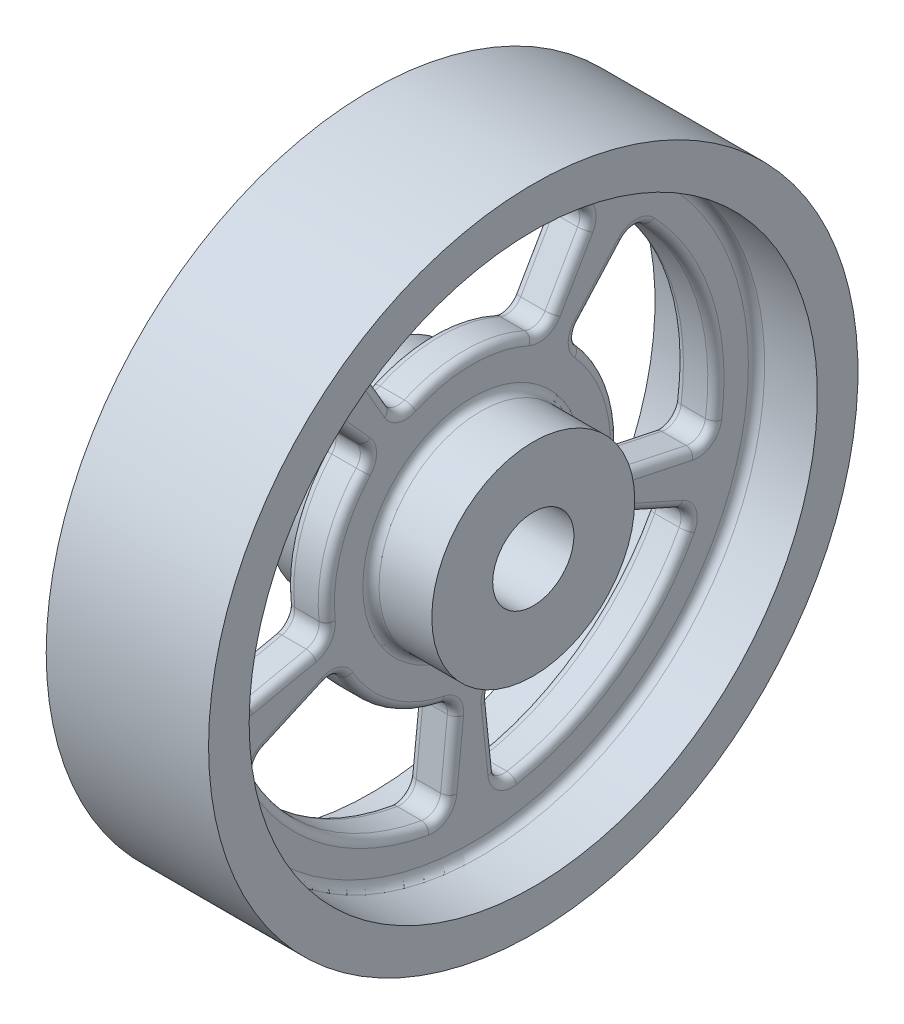
from build123d import *

# Parameters (mm, degrees)
CUT_EXTRUDE1_DEPTH       = 58.933151131
FILLET2_R                = 2
FILLET3_R                = 2
FILLET4_R                = 2
FILLET5_R                = 2
CIRPATTERN1_COUNT        = 5
FILLET2_OF_CIRPATTERN1_R = 2
FILLET3_OF_CIRPATTERN1_R = 2
FILLET4_OF_CIRPATTERN1_R = 2
FILLET5_OF_CIRPATTERN1_R = 2
FILLET11_R               = 1
FILLET12_R               = 1


with BuildPart() as part:
    # Sketch2 → Revolve1 (revolve)
    with BuildSketch(Plane.XY, mode=Mode.PRIVATE) as revolve1_sk:
        Polygon((-10, 35), (-2.5, 35), (-2.5, 12.5), (-10, 12.5), (-10, 5), (10, 5), (10, 12.5), (2.5, 12.5), (2.5, 35), (10, 35), (10, 40), (-10, 40), align=None)
    revolve(revolve1_sk.sketch.rotate(Axis((0, 0, 0), (1, 0, 0)), 90), axis=Axis((0, 0, 0), (1, 0, 0)))

    # Sketch4 → Cut-Extrude1 (cut, through all)
    with BuildSketch(Plane(origin=(2.5, 0, 0), x_dir=(0, 0, -1), z_dir=(1, 0, 0))):
        with BuildLine():
            Line((-15, 25.980762114), (-9, 15.588457268))
            ThreePointArc((-9, 15.588457268), (0, 18), (9, 15.588457268))
            Line((9, 15.588457268), (15, 25.980762114))
            ThreePointArc((15, 25.980762114), (0, 30), (-15, 25.980762114))
        make_face()
    cut_extrude1 = extrude(amount=-CUT_EXTRUDE1_DEPTH, mode=Mode.SUBTRACT)

    # Fillet2
    fillet2_edges = [part.edges().sort_by_distance(p)[0] for p in [
        (0, 25.980762114, -15),
    ]]
    fillet(fillet2_edges, radius=FILLET2_R)

    # Fillet3
    fillet3_edges = [part.edges().sort_by_distance(p)[0] for p in [
        (0, 15.588457268, -9),
    ]]
    fillet(fillet3_edges, radius=FILLET3_R)

    # Fillet4
    fillet4_edges = [part.edges().sort_by_distance(p)[0] for p in [
        (0, 15.588457268, 9),
    ]]
    fillet(fillet4_edges, radius=FILLET4_R)

    # Fillet5
    fillet5_edges = [part.edges().sort_by_distance(p)[0] for p in [
        (0, 25.980762114, 15),
    ]]
    fillet(fillet5_edges, radius=FILLET5_R)

    # CirPattern1: Cut-Extrude1 ×5 about axis
    cirpattern1_axis = Axis((0, 0, 0), (1, 0, 0))
    for i in range(1, CIRPATTERN1_COUNT):
        add(cut_extrude1.rotate(cirpattern1_axis, i * 360 / CIRPATTERN1_COUNT), mode=Mode.SUBTRACT)

    # Fillet2 of CirPattern1
    fillet2_of_cirpattern1_edges = [part.edges().sort_by_distance(p)[0] for p in [
        (0, 22.294344764, 20.073918191),
        (0, -12.202099292, 27.406363729),
        (0, -29.835656861, -3.135853898),
        (0, -6.237350725, -29.344428022),
    ]]
    fillet(fillet2_of_cirpattern1_edges, radius=FILLET2_OF_CIRPATTERN1_R)

    # Fillet3 of CirPattern1
    fillet3_of_cirpattern1_edges = [part.edges().sort_by_distance(p)[0] for p in [
        (0, 13.376606859, 12.044350914),
        (0, -7.321259575, 16.443818238),
        (0, -17.901394117, -1.881512339),
        (0, -3.742410435, -17.606656813),
    ]]
    fillet(fillet3_of_cirpattern1_edges, radius=FILLET3_OF_CIRPATTERN1_R)

    # Fillet4 of CirPattern1
    fillet4_of_cirpattern1_edges = [part.edges().sort_by_distance(p)[0] for p in [
        (0, -3.742410435, 17.606656813),
        (0, -17.901394117, 1.881512339),
        (0, -7.321259575, -16.443818238),
        (0, 13.376606859, -12.044350914),
    ]]
    fillet(fillet4_of_cirpattern1_edges, radius=FILLET4_OF_CIRPATTERN1_R)

    # Fillet5 of CirPattern1
    fillet5_of_cirpattern1_edges = [part.edges().sort_by_distance(p)[0] for p in [
        (0, -6.237350725, 29.344428022),
        (0, -29.835656861, 3.135853898),
        (0, -12.202099292, -27.406363729),
        (0, 22.294344764, -20.073918191),
    ]]
    fillet(fillet5_of_cirpattern1_edges, radius=FILLET5_OF_CIRPATTERN1_R)

    # Fillet11
    fillet11_edges = [part.edges().sort_by_distance(p)[0] for p in [
        (2.5, 0, -12.5),
        (2.5, 0, -35),
        (2.5, 9.270509831, -28.531695489),
        (2.5, -5.487704354, -28.882524769),
        (2.5, -24.270509831, -17.633557569),
        (2.5, -29.164707294, -3.706074009),
        (2.5, -24.270509831, 17.633557569),
        (2.5, -12.537076026, 26.592045067),
        (2.5, 9.270509831, 28.531695489),
        (2.5, 21.416368191, 20.14086169),
        (2.5, -4.972023962, -23.391533639),
        (2.5, -3.352979753, -18.260009279),
        (2.5, -23.783110394, -2.49970563),
        (2.5, -18.402428538, -2.453779941),
        (2.5, -9.726746619, 21.846630597),
        (2.5, -8.020346559, 16.743489875),
        (2.5, 17.771650383, 16.001665879),
        (2.5, 13.445581763, 12.801825774),
        (2.5, 5.562305899, -17.119017293),
        (2.5, 13.445581763, -12.801825774),
        (2.5, -14.562305899, -10.580134541),
        (2.5, -8.020346559, -16.743489875),
        (2.5, -14.562305899, 10.580134541),
        (2.5, -18.402428538, 2.453779941),
        (2.5, 5.562305899, 17.119017293),
        (2.5, -3.352979753, 18.260009279),
        (2.5, 17.771650383, -16.001665879),
        (2.5, 21.416368191, -20.14086169),
        (2.5, -9.726746619, -21.846630597),
        (2.5, -12.537076026, -26.592045067),
        (2.5, -23.783110394, 2.49970563),
        (2.5, -29.164707294, 3.706074009),
        (2.5, -4.972023962, 23.391533639),
        (2.5, -5.487704354, 28.882524769),
        (2.5, 30, 0),
        (2.5, 25.773119483, -14.14430798),
        (2.5, 20.710230592, -11.957057207),
        (2.5, 16.330173087, -8.831526428),
        (2.5, 18, 0),
        (2.5, 16.330173087, 8.831526428),
        (2.5, 20.710230592, 11.957057207),
        (2.5, 25.773119483, 14.14430798),
    ]]
    fillet(fillet11_edges, radius=FILLET11_R)

    # Fillet12
    fillet12_edges = [part.edges().sort_by_distance(p)[0] for p in [
        (-2.5, 0, -35),
        (-2.5, 0, -12.5),
        (-2.5, 9.270509831, -28.531695489),
        (-2.5, -5.487704354, -28.882524769),
        (-2.5, -24.270509831, -17.633557569),
        (-2.5, -29.164707294, -3.706074009),
        (-2.5, -24.270509831, 17.633557569),
        (-2.5, -12.537076026, 26.592045067),
        (-2.5, 9.270509831, 28.531695489),
        (-2.5, 21.416368191, 20.14086169),
        (-2.5, -4.972023962, -23.391533639),
        (-2.5, -3.352979753, -18.260009279),
        (-2.5, -23.783110394, -2.49970563),
        (-2.5, -18.402428538, -2.453779941),
        (-2.5, -9.726746619, 21.846630597),
        (-2.5, -8.020346559, 16.743489875),
        (-2.5, 17.771650383, 16.001665879),
        (-2.5, 13.445581763, 12.801825774),
        (-2.5, 5.562305899, -17.119017293),
        (-2.5, 13.445581763, -12.801825774),
        (-2.5, -14.562305899, -10.580134541),
        (-2.5, -8.020346559, -16.743489875),
        (-2.5, -14.562305899, 10.580134541),
        (-2.5, -18.402428538, 2.453779941),
        (-2.5, 5.562305899, 17.119017293),
        (-2.5, -3.352979753, 18.260009279),
        (-2.5, 17.771650383, -16.001665879),
        (-2.5, 21.416368191, -20.14086169),
        (-2.5, -9.726746619, -21.846630597),
        (-2.5, -12.537076026, -26.592045067),
        (-2.5, -23.783110394, 2.49970563),
        (-2.5, -29.164707294, 3.706074009),
        (-2.5, -4.972023962, 23.391533639),
        (-2.5, -5.487704354, 28.882524769),
        (-2.5, 30, 0),
        (-2.5, 25.773119483, -14.14430798),
        (-2.5, 20.710230592, -11.957057207),
        (-2.5, 16.330173087, -8.831526428),
        (-2.5, 18, 0),
        (-2.5, 16.330173087, 8.831526428),
        (-2.5, 20.710230592, 11.957057207),
        (-2.5, 25.773119483, 14.14430798),
    ]]
    fillet(fillet12_edges, radius=FILLET12_R)


solid = part.part
